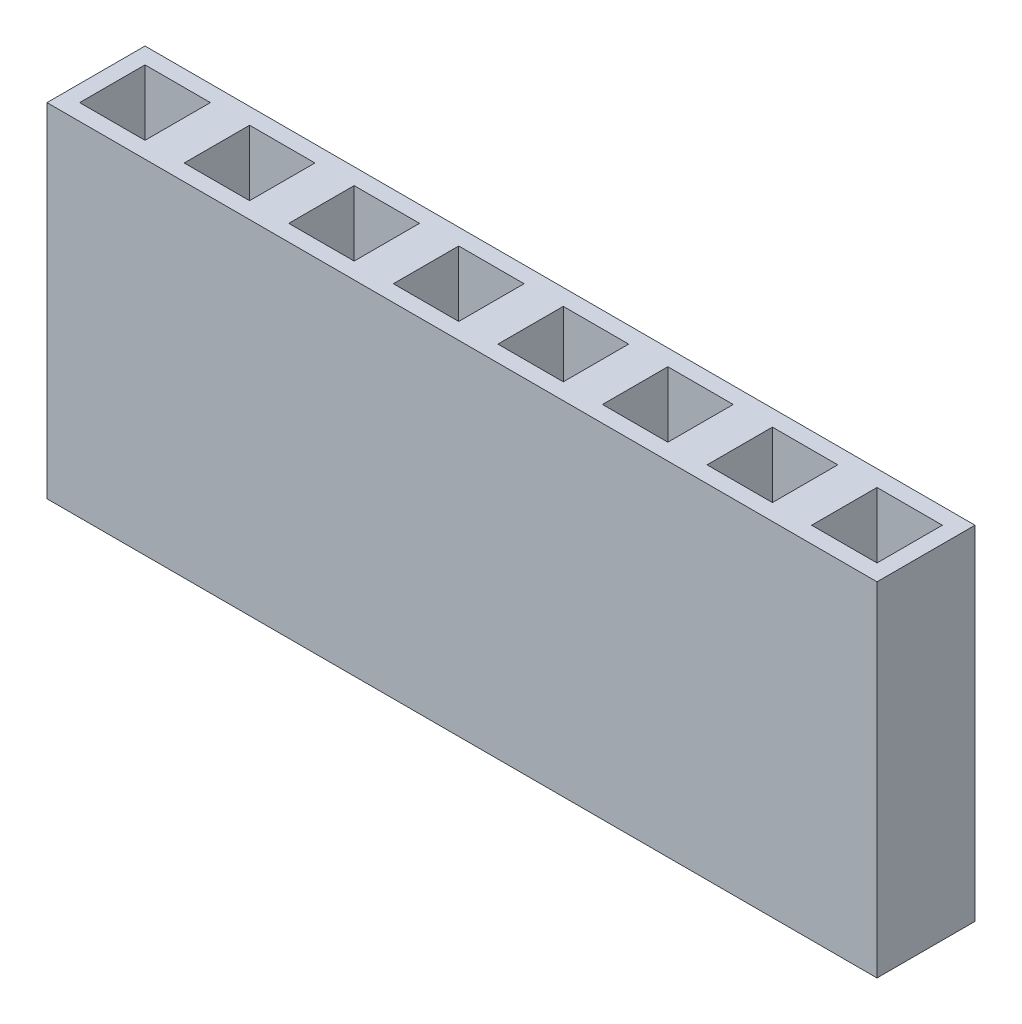
from build123d import *

# Parameters (mm, degrees)
ESBO_O1_W                = 38.4
ESBO_O1_H                = 8.4
RESSALTO_EXTRUS_O1_DEPTH = 2.4
ESBO_O2_W                = 1.6
ESBO_O2_H                = 1.6
CORTE_EXTRUS_O1_DEPTH    = 2.5
PADR_O_LINEAR1_COUNT     = 16
PADR_O_LINEAR1_PITCH     = 2.56
ESBO_O3_R                = 0.51
CORTE_EXTRUS_O2_DEPTH    = 21.228939666
PADR_O_LINEAR2_COUNT     = 15
PADR_O_LINEAR2_PITCH     = 2.543
ESBO_O6_W                = 18.080220827
ESBO_O6_H                = 8.4
CORTE_EXTRUS_O3_DEPTH    = 10


with BuildPart() as part:
    # Esboço1 → Ressalto-extrusão1 (new body)
    with BuildSketch(Plane.XY):
        Rectangle(ESBO_O1_W, ESBO_O1_H)
    extrude(amount=RESSALTO_EXTRUS_O1_DEPTH)

    # Esboço2 → Corte-extrusão1 (cut)
    with BuildSketch(Plane(origin=(0, 4.2, 0), x_dir=(1, 0, 0), z_dir=(0, 1, 0))):
        with Locations((-18, -1.2)):
            Rectangle(ESBO_O2_W, ESBO_O2_H)
    corte_extrus_o1 = extrude(amount=-CORTE_EXTRUS_O1_DEPTH, mode=Mode.SUBTRACT)

    # Padrão linear1: Corte-extrusão1 ×16
    with Locations(*[(i * PADR_O_LINEAR1_PITCH, 0, 0) for i in range(1, PADR_O_LINEAR1_COUNT)]):
        add(corte_extrus_o1, mode=Mode.SUBTRACT)

    # Esboço3 → Corte-extrusão2 (cut, through all)
    with BuildSketch(Plane(origin=(0, 1.7, 0), x_dir=(1, 0, 0), z_dir=(0, 1, 0))):
        with Locations(Location((-18, -1.2, 0), (0, 0, 270))):
            Circle(ESBO_O3_R)
    corte_extrus_o2 = extrude(amount=-CORTE_EXTRUS_O2_DEPTH, mode=Mode.SUBTRACT)

    # Padrão linear2: Corte-extrusão2 ×15
    with Locations(*[(i * PADR_O_LINEAR2_PITCH, 0, 0) for i in range(1, PADR_O_LINEAR2_COUNT)]):
        add(corte_extrus_o2, mode=Mode.SUBTRACT)

    # Esboço6 → Corte-extrusão3 (cut)
    with BuildSketch(Plane.XY.offset(2.4)):
        with Locations((10.159889587, 0)):
            Rectangle(ESBO_O6_W, ESBO_O6_H)
    extrude(amount=-CORTE_EXTRUS_O3_DEPTH, mode=Mode.SUBTRACT)


solid = part.part
